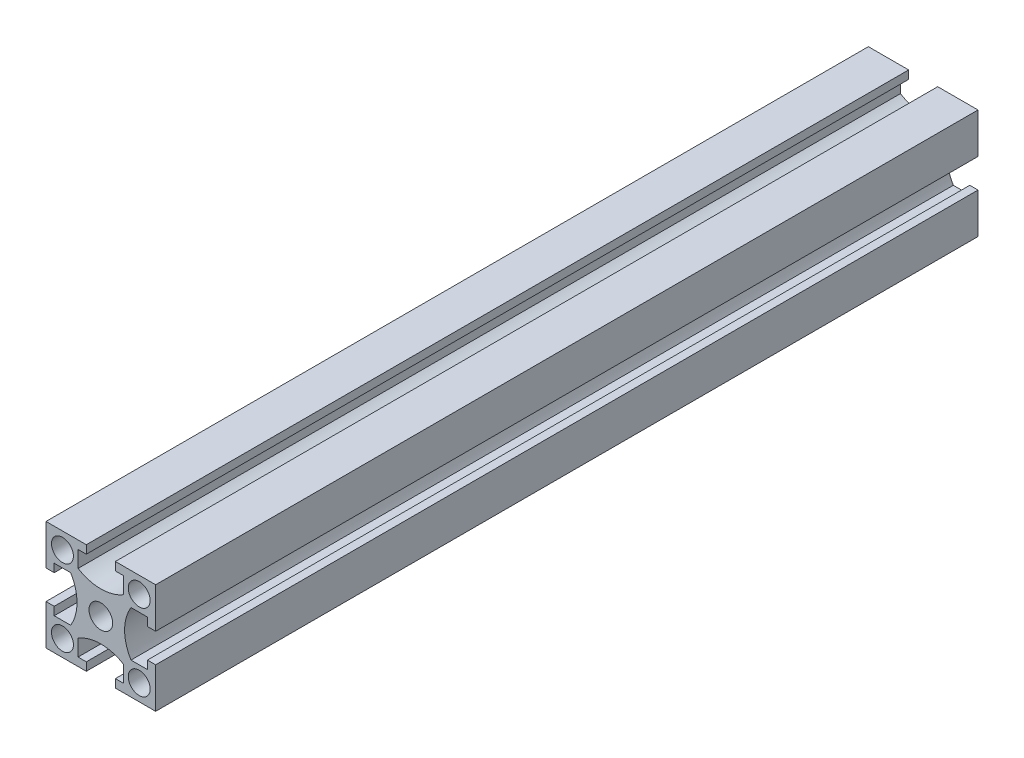
from build123d import *

# Parameters (mm, degrees)
SKETCH_1_W          = 20
SKETCH_1_H          = 20
EXTRUDE_1_DEPTH     = 150
SKETCH_2_R          = 2.15
SKETCH_2_R_2        = 2
CUT_EXTRUDE_1_DEPTH = 300


with BuildPart() as part:
    # 스케치1 → 보스-돌출1 (new body)
    with BuildSketch(Plane.XY):
        Rectangle(SKETCH_1_W, SKETCH_1_H)
    extrude(amount=EXTRUDE_1_DEPTH)

    # 스케치2 → 컷-돌출1 (cut)
    with BuildSketch(Plane.XY.offset(150)):
        Circle(SKETCH_2_R)
        with Locations((-7, 7)):
            Circle(SKETCH_2_R_2)
        with Locations((7, 7)):
            Circle(SKETCH_2_R_2)
        with Locations((7, -7)):
            Circle(SKETCH_2_R_2)
        with Locations((-7, -7)):
            Circle(SKETCH_2_R_2)
        with BuildLine():
            Line((-2.65, 10), (-2.65, 8.5))
            Line((-2.65, 8.5), (-4.15, 8.5))
            Line((-4.15, 8.5), (-4.15, 5.5))
            ThreePointArc((-4.15, 5.5), (0, 4.339407869), (4.15, 5.5))
            Line((4.15, 5.5), (4.15, 8.5))
            Line((4.15, 8.5), (2.65, 8.5))
            Line((2.65, 8.5), (2.65, 10))
            Line((2.65, 10), (-2.65, 10))
        make_face()
        with BuildLine():
            Line((10, 2.65), (8.5, 2.65))
            Line((8.5, 2.65), (8.5, 4.15))
            Line((8.5, 4.15), (5.5, 4.15))
            ThreePointArc((5.5, 4.15), (4.339407869, 0), (5.5, -4.15))
            Line((5.5, -4.15), (8.5, -4.15))
            Line((8.5, -4.15), (8.5, -2.65))
            Line((8.5, -2.65), (10, -2.65))
            Line((10, -2.65), (10, 2.65))
        make_face()
        with BuildLine():
            Line((2.65, -10), (2.65, -8.5))
            Line((2.65, -8.5), (4.15, -8.5))
            Line((4.15, -8.5), (4.15, -5.5))
            ThreePointArc((4.15, -5.5), (0, -4.339407869), (-4.15, -5.5))
            Line((-4.15, -5.5), (-4.15, -8.5))
            Line((-4.15, -8.5), (-2.65, -8.5))
            Line((-2.65, -8.5), (-2.65, -10))
            Line((-2.65, -10), (2.65, -10))
        make_face()
        with BuildLine():
            Line((-10, -2.65), (-8.5, -2.65))
            Line((-8.5, -2.65), (-8.5, -4.15))
            Line((-8.5, -4.15), (-5.5, -4.15))
            ThreePointArc((-5.5, -4.15), (-4.339407869, 0), (-5.5, 4.15))
            Line((-5.5, 4.15), (-8.5, 4.15))
            Line((-8.5, 4.15), (-8.5, 2.65))
            Line((-8.5, 2.65), (-10, 2.65))
            Line((-10, 2.65), (-10, -2.65))
        make_face()
    extrude(amount=-CUT_EXTRUDE_1_DEPTH, mode=Mode.SUBTRACT)


solid = part.part
